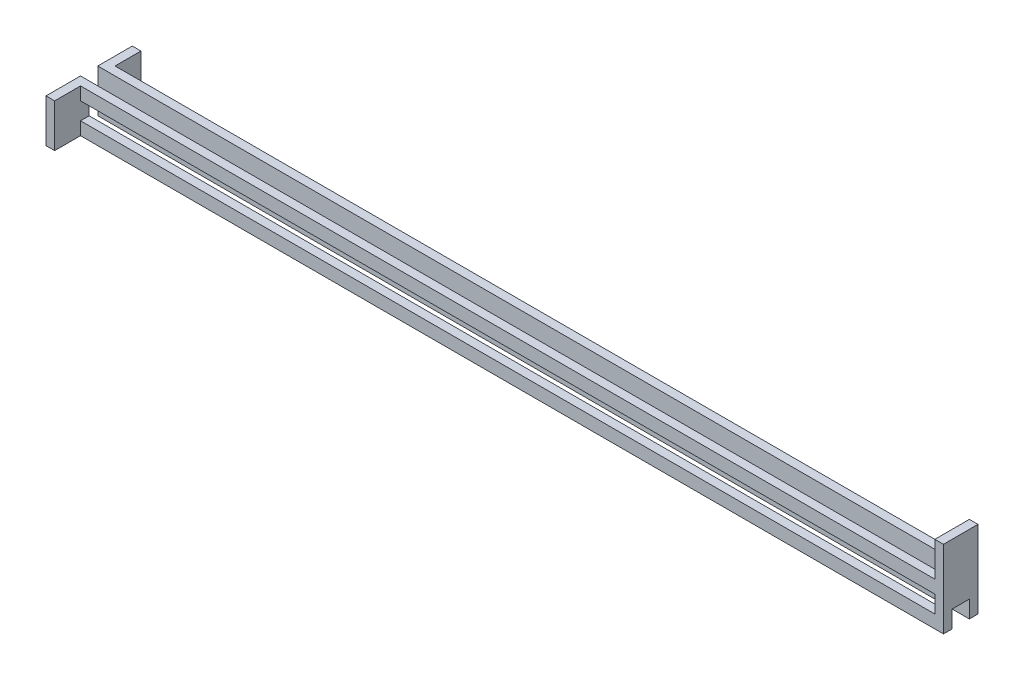
from build123d import *

# Parameters (mm, degrees)
EXTRUDE_1_DEPTH          = 60
SKETCH_2_W               = 10
SKETCH_2_H               = 40
EXTRUDE_1_2_DEPTH        = 30
SKETCH_3_W               = 40
SKETCH_3_H               = 60
EXTRUDE_2_DEPTH          = 10
CUT_EXTRUDE_1_DEPTH      = 1017.415269464
CUT_EXTRUDE_1_DEPTH_BACK = 1017.415269464
SKETCH_4_W               = 1028.133255753
SKETCH_4_H               = 25
SKETCH_5_W               = 990
SKETCH_5_H               = 10
CUT_EXTRUDE_2_DEPTH      = 16
CUT_EXTRUDE_3_DEPTH      = 1016.775565762
CUT_EXTRUDE_3_DEPTH_BACK = 1016.775565762
SKETCH_7_W               = 20
SKETCH_7_H               = 20


with BuildPart() as part:
    # 草图1 → Extrude 1 (new body)
    with BuildSketch(Plane(origin=(0, 0, 0), x_dir=(1, 0, 0), z_dir=(0, 1, 0))):
        Polygon((0, 10.786516854), (0, 0), (1000, 0), (1000, -20), (0, -20), (0, -30.786516854), (10, -30.786516854), (10, -30), (1010, -30), (1010, 10), (10, 10), (10, 10.786516854), align=None)
    extrude(amount=EXTRUDE_1_DEPTH)

    # 草图2 → Extrude 1 2 (add)
    with BuildSketch(Plane(origin=(0, 60, 0), x_dir=(1, 0, 0), z_dir=(0, 1, 0))):
        with Locations((1005, -10)):
            Rectangle(SKETCH_2_W, SKETCH_2_H)
    extrude(amount=EXTRUDE_1_2_DEPTH)

    # 草图3 → 凸台-拉伸2 (add)
    with BuildSketch(Plane.ZY):
        with Locations((-20, 30)):
            Rectangle(SKETCH_3_W, SKETCH_3_H)
        with Locations((40, 30)):
            Rectangle(SKETCH_3_W, SKETCH_3_H)
    extrude(amount=-EXTRUDE_2_DEPTH)

    # 草图4 → 切除-拉伸1 (cut, two sides: drawn at the far end of the back side and taken through both)
    with BuildSketch(Plane.XY.offset(30).offset(-CUT_EXTRUDE_1_DEPTH_BACK)):
        with Locations((485.933372124, 62.5)):
            Rectangle(SKETCH_4_W, SKETCH_4_H)
    extrude(amount=CUT_EXTRUDE_1_DEPTH + CUT_EXTRUDE_1_DEPTH_BACK, mode=Mode.SUBTRACT)

    # 草图5 → 切除-拉伸2 (cut, symmetric)
    with BuildSketch(Plane.XY.offset(30)):
        with Locations((505, 30)):
            Rectangle(SKETCH_5_W, SKETCH_5_H)
        with Locations((505, 20)):
            Rectangle(SKETCH_5_W, SKETCH_5_H)
    extrude(amount=CUT_EXTRUDE_2_DEPTH, both=True, mode=Mode.SUBTRACT)

    # 草图7 → 切除-拉伸3 (cut, two sides: drawn at the far end of the back side and taken through both)
    with BuildSketch(Plane(origin=(1010, 0, 0), x_dir=(0, 0, -1), z_dir=(1, 0, 0)).offset(-CUT_EXTRUDE_3_DEPTH_BACK)):
        with Locations((-10, 10)):
            Rectangle(SKETCH_7_W, SKETCH_7_H)
    extrude(amount=CUT_EXTRUDE_3_DEPTH + CUT_EXTRUDE_3_DEPTH_BACK, mode=Mode.SUBTRACT)


solid = part.part
